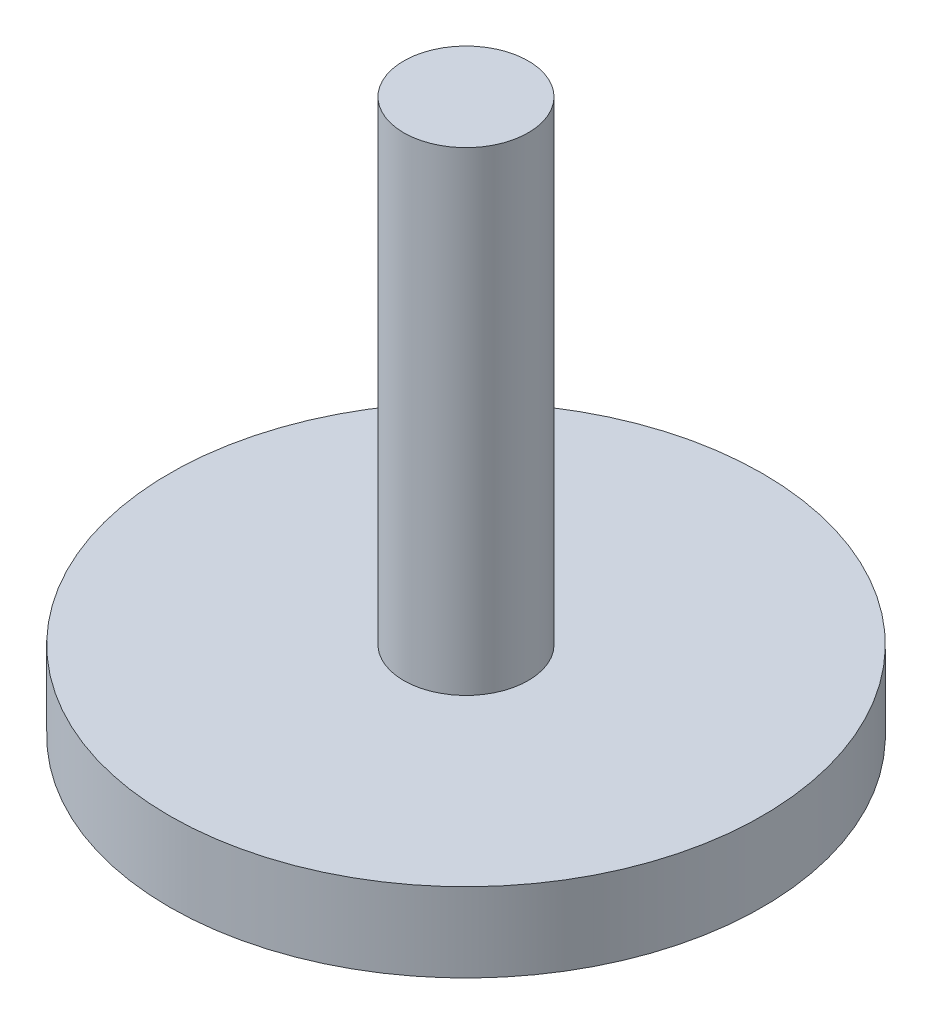
from build123d import *

# Parameters (mm, degrees)
SKETCH_1_R      = 7.5
EXTRUDE_1_DEPTH = 2
SKETCH_2_R      = 1.575
EXTRUDE_2_DEPTH = 12


with BuildPart() as part:
    # ｽｹｯﾁ1 → ﾎﾞｽ - 押し出し1 (new body)
    with BuildSketch(Plane(origin=(0, 0, 0), x_dir=(1, 0, 0), z_dir=(0, 1, 0))):
        with Locations(Location((0, 0, 0), (0, 0, 270))):
            Circle(SKETCH_1_R)
    extrude(amount=EXTRUDE_1_DEPTH)

    # ｽｹｯﾁ2 → ﾎﾞｽ - 押し出し2 (add)
    with BuildSketch(Plane(origin=(0, 2, 0), x_dir=(1, 0, 0), z_dir=(0, 1, 0))):
        with Locations(Location((0, 0, 0), (0, 0, 270))):
            Circle(SKETCH_2_R)
    extrude(amount=EXTRUDE_2_DEPTH)


solid = part.part
